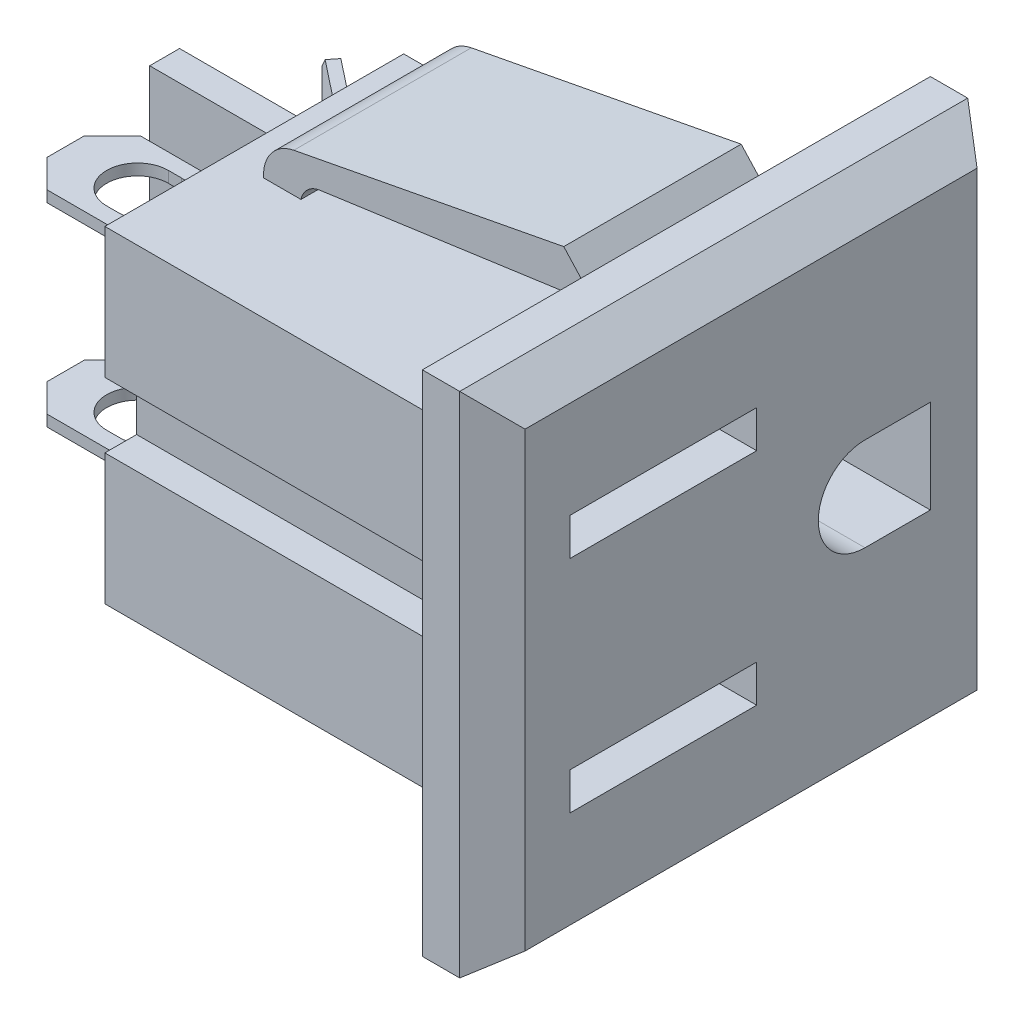
from build123d import *
from OCP.BRepFilletAPI import BRepFilletAPI_MakeChamfer

# Parameters (mm, degrees)
CROQUIS1_W                = 27.2
CROQUIS1_H                = 27.2
SALIENTE_EXTRUIR1_DEPTH   = 4
CHAFL_N1_SIZE             = 2
CHAFL_N1_SIZE2            = 1.5
SALIENTE_EXTRUIR2_DEPTH   = 20
CORTAR_EXTRUIR1_DEPTH     = 1.5
SALIENTE_EXTRUIR3_DEPTH   = 9.5
CROQUIS6_W                = 13
CROQUIS6_H                = 1.6
SALIENTE_EXTRUIR4_DEPTH   = 8.5
CROQUIS7_W                = 0.6
CROQUIS7_H                = 10
SALIENTE_EXTRUIR5_DEPTH   = 8
SALIENTE_EXTRUIR5_2_DEPTH = 8
CORTAR_EXTRUIR2_DEPTH     = 41.075179351
SALIENTE_EXTRUIR6_DEPTH   = 5
CORTAR_EXTRUIR3_DEPTH     = 0.6
CROQUIS11_W               = 2
CROQUIS11_H               = 10
CORTAR_EXTRUIR4_DEPTH     = 23.5
CROQUIS12_W               = 1.4
CROQUIS12_H               = 10
CORTAR_EXTRUIR5_DEPTH     = 0.55


with BuildPart() as part:
    # Croquis1 → Saliente-Extruir1 (new body)
    with BuildSketch(Plane.YZ):
        Rectangle(CROQUIS1_W, CROQUIS1_H)
    extrude(amount=-SALIENTE_EXTRUIR1_DEPTH)

    # Chaflán1: one chamfer whose edges measure the first distance from different faces: ONE call of the kernel's chamfer builder (chamfer() names one face for all edges)
    chafl_n1_edges_1 = [part.edges().sort_by_distance(p)[0] for p in [
        (0, 0, -13.6),
    ]]
    chafl_n1_side_1 = [part.faces().sort_by_distance(p)[0] for p in [
        (-2, 0, -13.6),
    ]]
    chafl_n1_edges_2 = [part.edges().sort_by_distance(p)[0] for p in [
        (0, -13.6, 0),
    ]]
    chafl_n1_side_2 = [part.faces().sort_by_distance(p)[0] for p in [
        (-2, -13.6, 0),
    ]]
    chafl_n1_edges_3 = [part.edges().sort_by_distance(p)[0] for p in [
        (0, 0, 13.6),
    ]]
    chafl_n1_side_3 = [part.faces().sort_by_distance(p)[0] for p in [
        (-2, 0, 13.6),
    ]]
    chafl_n1_edges_4 = [part.edges().sort_by_distance(p)[0] for p in [
        (0, 13.6, 0),
    ]]
    chafl_n1_side_4 = [part.faces().sort_by_distance(p)[0] for p in [
        (-2, 13.6, 0),
    ]]
    chafl_n1 = BRepFilletAPI_MakeChamfer(part.part.solid().wrapped)
    for e in chafl_n1_edges_1:
        chafl_n1.Add(CHAFL_N1_SIZE, CHAFL_N1_SIZE2, e.wrapped, chafl_n1_side_1[0].wrapped)  # the first distance lies on this face
    for e in chafl_n1_edges_2:
        chafl_n1.Add(CHAFL_N1_SIZE, CHAFL_N1_SIZE2, e.wrapped, chafl_n1_side_2[0].wrapped)  # the first distance lies on this face
    for e in chafl_n1_edges_3:
        chafl_n1.Add(CHAFL_N1_SIZE, CHAFL_N1_SIZE2, e.wrapped, chafl_n1_side_3[0].wrapped)  # the first distance lies on this face
    for e in chafl_n1_edges_4:
        chafl_n1.Add(CHAFL_N1_SIZE, CHAFL_N1_SIZE2, e.wrapped, chafl_n1_side_4[0].wrapped)  # the first distance lies on this face
    add(Compound.cast(chafl_n1.Shape()), mode=Mode.REPLACE)

    # Croquis3 → Saliente-Extruir2 (add)
    with BuildSketch(Plane(origin=(-4, 0, 0), x_dir=(0, -1, 0), z_dir=(-1, 0, 0))):
        Polygon((1.75, 10.6), (8.75, 10.6), (8.75, -5.4), (4.5, -5.4), (4.5, -11.4), (-4.5, -11.4), (-4.5, -5.4), (-8.75, -5.4), (-8.75, 10.6), (-1.75, 10.6), (-1.75, 8.9), (1.75, 8.9), align=None)
    extrude(amount=SALIENTE_EXTRUIR2_DEPTH)

    # Croquis4 → Cortar-Extruir1 (cut)
    with BuildSketch(Plane(origin=(-4, 0, 0), x_dir=(0, -1, 0), z_dir=(-1, 0, 0))):
        Polygon((-12.1, -5.4), (-4.5, -5.4), (-4.5, -11.4), (4.5, -11.4), (4.5, -5.4), (12.1, -5.4), (12.1, -12.1), (-12.1, -12.1), align=None)
    extrude(amount=-CORTAR_EXTRUIR1_DEPTH, mode=Mode.SUBTRACT)

    # Croquis5 → Saliente-Extruir3 (add)
    with BuildSketch(Plane(origin=(0, 0, -5.4), x_dir=(1, 0, 0), z_dir=(0, 0, -1))):
        with BuildLine():
            Line((-18.994456696, 9.683127454), (-4.239462472, 11.756806658))
            Line((-4.239462472, 11.756806658), (-5.928437991, 13.6))
            Line((-5.928437991, 13.6), (-20.378917468, 10.843423613))
            ThreePointArc((-20.378917468, 10.843423613), (-21.585467879, 10.103369046), (-22, 8.75))
            Line((-22, 8.75), (-20, 8.75))
            ThreePointArc((-20, 8.75), (-19.643712486, 9.374415844), (-18.994456696, 9.683127454))
        make_face()
        with BuildLine():
            Line((-5.928437991, -13.6), (-20.378917468, -10.843423613))
            ThreePointArc((-20.378917468, -10.843423613), (-21.585467879, -10.103369046), (-22, -8.75))
            Line((-22, -8.75), (-20, -8.75))
            ThreePointArc((-20, -8.75), (-19.643712486, -9.374415844), (-18.994456696, -9.683127454))
            Line((-18.994456696, -9.683127454), (-4.239462472, -11.756806658))
            Line((-4.239462472, -11.756806658), (-5.928437991, -13.6))
        make_face()
    extrude(amount=-SALIENTE_EXTRUIR3_DEPTH)

    # Croquis6 → Saliente-Extruir4 (add)
    with BuildSketch(Plane(origin=(-24, 0, 0), x_dir=(0, -1, 0), z_dir=(-1, 0, 0))):
        with Locations((0, -1.1)):
            Rectangle(CROQUIS6_W, CROQUIS6_H)
    extrude(amount=SALIENTE_EXTRUIR4_DEPTH)

    # Croquis9 → Saliente-Extruir6 (add, symmetric)
    with BuildSketch(Plane(origin=(0, 0, 0), x_dir=(-1, 0, 0), z_dir=(0, 1, 0))):
        Polygon((24, -2.9), (32.871657681, -9.9), (32.5, -10.371031388), (23.628342319, -3.371031388), align=None)
    extrude(amount=SALIENTE_EXTRUIR6_DEPTH, both=True)

    # Croquis10 → Cortar-Extruir3 (cut)
    with BuildSketch(Plane(origin=(-7.798403611, 0, 9.883538185), x_dir=(0.7850523133577078, 0, 0.6194294675681095), z_dir=(-0.6194294675681093, 0, 0.7850523133577076))):
        Polygon((-31.938322635, -1.5), (-31.938322635, -5), (-21.111018702, -5), (-21.111018702, -4), (-25.938322635, -3.1), (-25.938322635, -2.5), (-30.938322635, -2.5), align=None)
        Polygon((-30.938322635, 2.5), (-31.938322635, 1.5), (-31.938322635, 5), (-21.111018702, 5), (-21.111018702, 4), (-25.938322635, 3.1), (-25.938322635, 2.5), align=None)
        with BuildLine():
            Line((-28.088322635, 1.65), (-27.388322635, 1.65))
            ThreePointArc((-27.388322635, 1.65), (-25.738322635, 0), (-27.388322635, -1.65))
            Line((-27.388322635, -1.65), (-28.088322635, -1.65))
            ThreePointArc((-28.088322635, -1.65), (-29.738322635, 0), (-28.088322635, 1.65))
        make_face()
    extrude(amount=-CORTAR_EXTRUIR3_DEPTH, mode=Mode.SUBTRACT)

    # Croquis11 → Cortar-Extruir4 (cut)
    with BuildSketch(Plane.YZ):
        with Locations((-5.9, 4.7)):
            Rectangle(CROQUIS11_W, CROQUIS11_H)
        with Locations((5.9, 4.7)):
            Rectangle(CROQUIS11_W, CROQUIS11_H)
        with BuildLine():
            Line((-2.5, -9.6), (2.5, -9.6))
            Line((2.5, -9.6), (2.5, -6.1))
            ThreePointArc((2.5, -6.1), (0, -3.6), (-2.5, -6.1))
            Line((-2.5, -6.1), (-2.5, -9.6))
        make_face()
    extrude(amount=-CORTAR_EXTRUIR4_DEPTH, mode=Mode.SUBTRACT)

    # Croquis12 → Cortar-Extruir5 (cut)
    with BuildSketch(Plane.YZ.offset(-23.5)):
        with Locations((-6.2, 4.7)):
            Rectangle(CROQUIS12_W, CROQUIS12_H)
        with Locations((6.2, 4.7)):
            Rectangle(CROQUIS12_W, CROQUIS12_H)
        with BuildLine():
            Line((-2.25, -5.010275264), (2.25, -5.010275264))
            ThreePointArc((2.25, -5.010275264), (0, -3.6), (-2.25, -5.010275264))
        make_face()
    extrude(amount=-CORTAR_EXTRUIR5_DEPTH, mode=Mode.SUBTRACT)


with BuildPart() as body_2:
    # Croquis7 → Saliente-Extruir5 (new body)
    with BuildSketch(Plane(origin=(-24, 0, 0), x_dir=(0, -1, 0), z_dir=(-1, 0, 0))):
        with Locations((-5.2, 4.7)):
            Rectangle(CROQUIS7_W, CROQUIS7_H)
    extrude(amount=SALIENTE_EXTRUIR5_DEPTH)


with BuildPart() as body_3:
    # Croquis7 → Saliente-Extruir5 2 (new body)
    with BuildSketch(Plane(origin=(-24, 0, 0), x_dir=(0, -1, 0), z_dir=(-1, 0, 0))):
        with Locations((5.2, 4.7)):
            Rectangle(CROQUIS7_W, CROQUIS7_H)
    extrude(amount=SALIENTE_EXTRUIR5_2_DEPTH)


with BuildPart() as cortar_extruir2_tool:
    # Croquis8 → Cortar-Extruir2 (new, through all)
    with BuildSketch(Plane(origin=(0, 5.5, 0), x_dir=(-1, 0, 0), z_dir=(0, 1, 0))):
        Polygon((24, -0.3), (25, 0.7), (25, 2.2), (30.5, 2.2), (32, 3.7), (32, -0.3), align=None)
        Polygon((32, 5.7), (32, 9.7), (24, 9.7), (25, 8.7), (25, 7.2), (30.5, 7.2), align=None)
        with BuildLine():
            Line((27.45, 6.35), (28.15, 6.35))
            ThreePointArc((28.15, 6.35), (29.8, 4.7), (28.15, 3.05))
            Line((28.15, 3.05), (27.45, 3.05))
            ThreePointArc((27.45, 3.05), (25.8, 4.7), (27.45, 6.35))
        make_face()
    extrude(amount=-CORTAR_EXTRUIR2_DEPTH)


with BuildPart() as body_2_1:
    add(body_2.part)

    # Cortar-Extruir2: cut by cortar_extruir2_tool
    add(cortar_extruir2_tool.part, mode=Mode.SUBTRACT)


with BuildPart() as body_3_1:
    add(body_3.part)

    # Cortar-Extruir2: cut by cortar_extruir2_tool
    add(cortar_extruir2_tool.part, mode=Mode.SUBTRACT)


solid = Compound([part.part, body_2_1.part, body_3_1.part])
